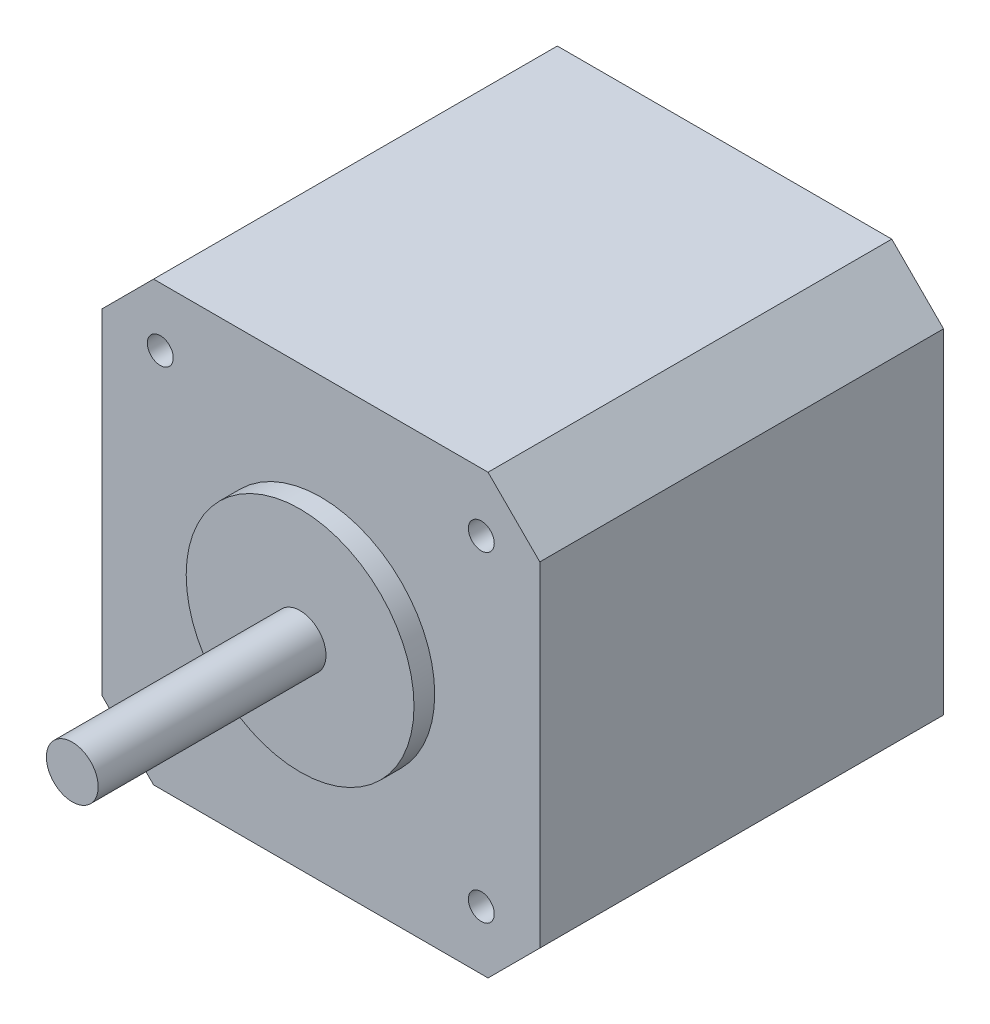
from build123d import *

# Parameters (mm, degrees)
BOSS_EXTRUDE1_DEPTH       = 38.989
M3X0_5_TAPPED_HOLE1_D     = 2.5
M3X0_5_TAPPED_HOLE1_DEPTH = 5
M3X0_5_TAPPED_HOLE1_TIP   = 0.751075774
SKETCH4_R                 = 11
BOSS_EXTRUDE2_DEPTH       = 2
SKETCH5_R                 = 2.5
BOSS_EXTRUDE3_DEPTH       = 22


with BuildPart() as part:
    # Sketch1 → Boss-Extrude1 (new body)
    with BuildSketch(Plane.XY):
        Polygon((0, 37.3), (5, 42.3), (37.3, 42.3), (42.3, 37.3), (42.3, 5), (37.3, 0), (5, 0), (0, 5), align=None)
    extrude(amount=BOSS_EXTRUDE1_DEPTH)

    # M3x0.5 Tapped Hole1
    with Locations(Plane.XY.offset(38.989)):
        with Locations((5.65, 36.65), (36.65, 36.65), (36.65, 5.65), (5.65, 5.65)):
            Hole(M3X0_5_TAPPED_HOLE1_D / 2, depth=M3X0_5_TAPPED_HOLE1_DEPTH)
            with Locations((0, 0, -(M3X0_5_TAPPED_HOLE1_DEPTH + M3X0_5_TAPPED_HOLE1_TIP / 2))):  # 118° drill point
                Cone(0, M3X0_5_TAPPED_HOLE1_D / 2, M3X0_5_TAPPED_HOLE1_TIP, mode=Mode.SUBTRACT)

    # Sketch4 → Boss-Extrude2 (add)
    with BuildSketch(Plane.XY.offset(38.989)):
        with Locations(Location((21.15, 21.15, 0), (0, 0, 180))):
            Circle(SKETCH4_R)
    extrude(amount=BOSS_EXTRUDE2_DEPTH)

    # Sketch5 → Boss-Extrude3 (add)
    with BuildSketch(Plane.XY.offset(40.989)):
        with Locations((21.15, 21.15)):
            Circle(SKETCH5_R)
    extrude(amount=BOSS_EXTRUDE3_DEPTH)


solid = part.part
